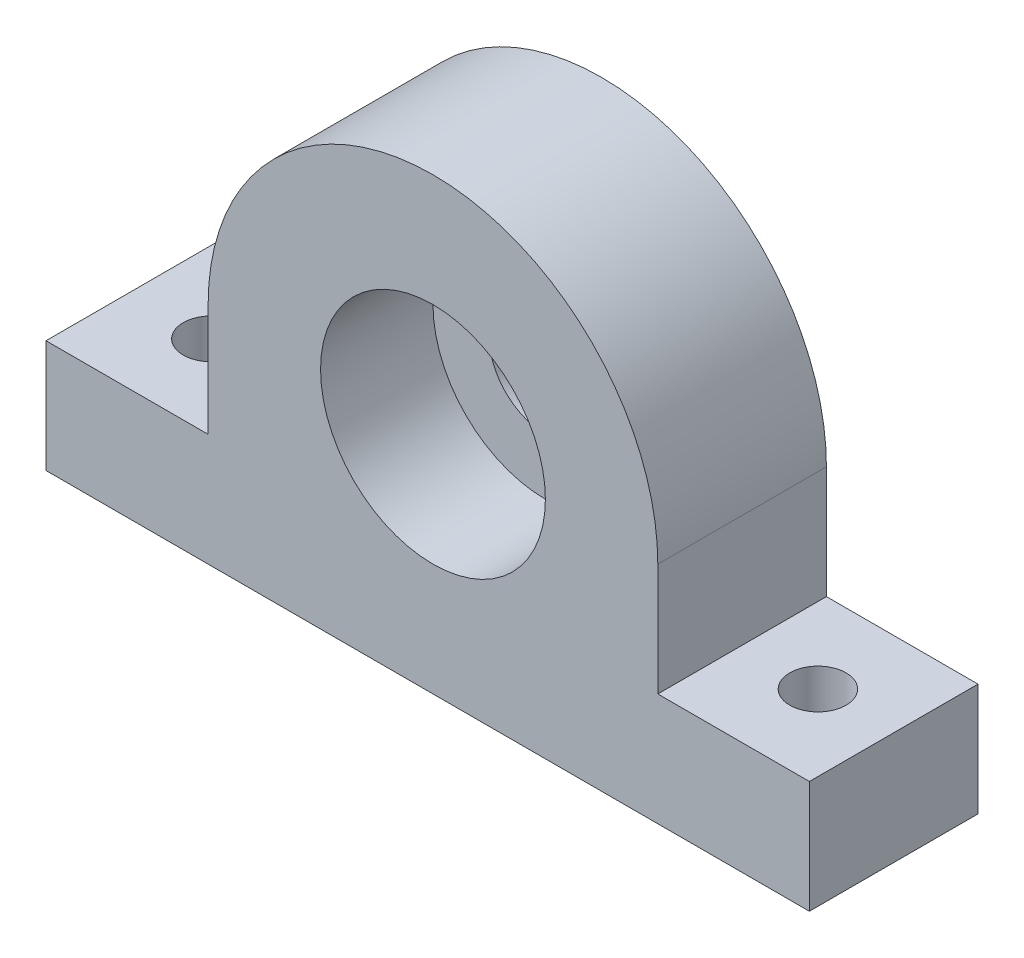
from build123d import *

# Parameters (mm, degrees)
SKETCH1_R           = 6.35
SKETCH1_W           = 18.316719234
SKETCH1_H           = 12.7
SKETCH1_W_2         = 17.123051237
BOSS_EXTRUDE1_DEPTH = 19.05
SKETCH2_R           = 12.7
CUT_EXTRUDE1_DEPTH  = 12.7
SKETCH3_R           = 3.175
CUT_EXTRUDE2_DEPTH  = 12.7


with BuildPart() as part:
    # Sketch1 → Boss-Extrude1 (new body)
    # profile 1 of 3: a face of its own
    with BuildSketch(Plane.XY):
        with BuildLine():
            Line((25.4, 25.4), (25.4, 0))
            Line((25.4, 0), (-25.4, 0))
            Line((-25.4, 0), (-25.4, 25.4))
            ThreePointArc((-25.4, 25.4), (0, 50.8), (25.4, 25.4))
        make_face()
        with Locations(Location((0, 25.4, 0), (0, 0, 180))):
            Circle(SKETCH1_R, mode=Mode.SUBTRACT)
    # profile 2 of 3: a face of its own
    with BuildSketch(Plane.XY):
        with Locations((-34.558359617, 6.35)):
            Rectangle(SKETCH1_W, SKETCH1_H)
    # profile 3 of 3: a face of its own
    with BuildSketch(Plane.XY):
        with Locations((33.961525619, 6.35)):
            Rectangle(SKETCH1_W_2, SKETCH1_H)
    extrude(amount=BOSS_EXTRUDE1_DEPTH)

    # Sketch2 → Cut-Extrude1 (cut)
    with BuildSketch(Plane.XY.offset(19.05)):
        with Locations((0, 25.4)):
            Circle(SKETCH2_R)
    extrude(amount=-CUT_EXTRUDE1_DEPTH, mode=Mode.SUBTRACT)

    # Sketch3 → Cut-Extrude2 (cut)
    with BuildSketch(Plane(origin=(0, 12.7, 0), x_dir=(1, 0, 0), z_dir=(0, 1, 0))):
        with Locations(Location((-34.558359617, -9.525, 0), (0, 0, 270))):
            Circle(SKETCH3_R)
        with Locations(Location((33.961525618, -9.525, 0), (0, 0, 270))):
            Circle(SKETCH3_R)
    extrude(amount=-CUT_EXTRUDE2_DEPTH, mode=Mode.SUBTRACT)


solid = part.part
